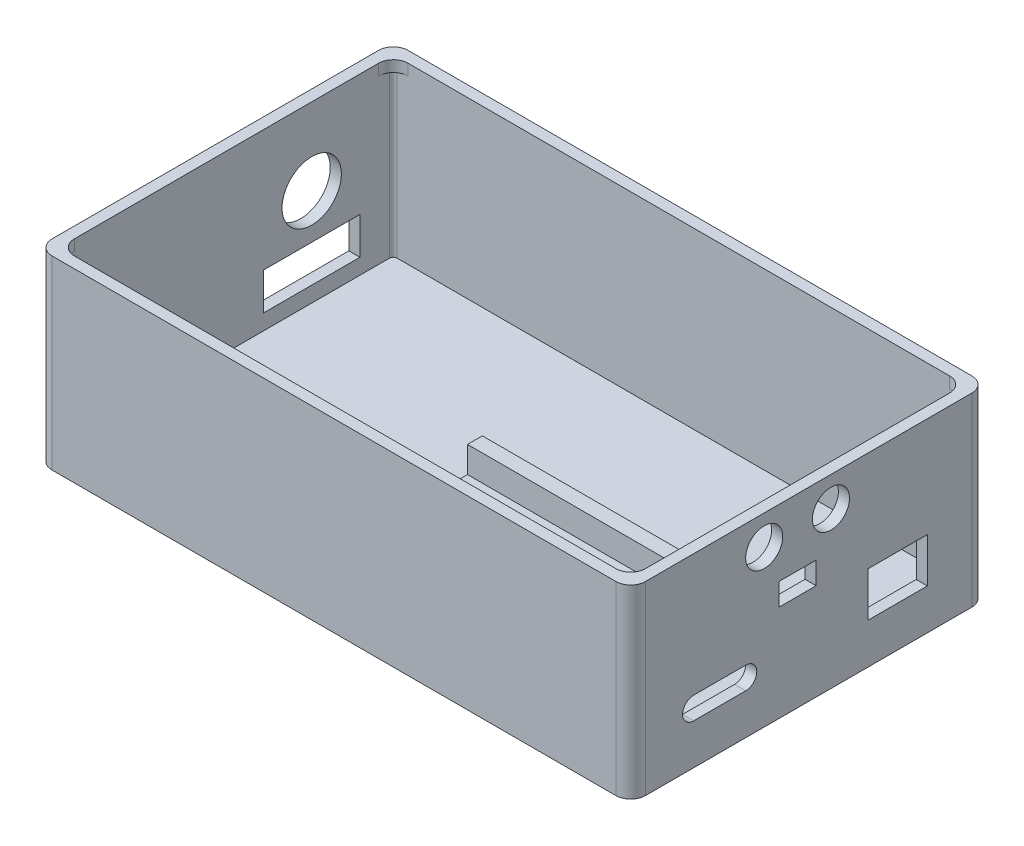
from build123d import *

# Parameters (mm, degrees)
SKETCH_3_W           = 80
SKETCH_3_H           = 48
EXTRUDE_1_DEPTH      = 25
FILLET_1_R           = 2
SHELL_1_T            = 1.5
SKETCH_5_W           = 45
SKETCH_5_H           = 2
EXTRUDE_2_DEPTH      = 8
EXTRUDE_START        = 4.48
EXTRUDE_3_DEPTH      = 4.48
SKETCH_8_W           = 8
SKETCH_8_H           = 6
CUT_EXTRUDE_2_DEPTH  = 4.03
CUT_EXTRUDE_3_DEPTH  = 4.03
SKETCH_11_W          = 13
SKETCH_11_H          = 5
CUT_EXTRUDE_4_DEPTH  = 4.03
SKETCH_12_W          = 5
SKETCH_12_H          = 3
CUT_EXTRUDE_5_DEPTH  = 4.03
SKETCH_13_R          = 2.5
CUT_EXTRUDE_6_DEPTH  = 4.03
SKETCH_14_R          = 4
CUT_EXTRUDE_7_DEPTH  = 4.03
CUT_EXTRUDE_12_DEPTH = 4.03
SKETCH_16_W          = 10
SKETCH_16_H          = 5
CUT_EXTRUDE_13_DEPTH = 4.03


with BuildPart() as part:
    # Эскиз3 → Бобышка-Вытянуть1 (new body)
    with BuildSketch(Plane(origin=(0, 0, 0), x_dir=(1, 0, 0), z_dir=(0, 1, 0))):
        Rectangle(SKETCH_3_W, SKETCH_3_H)
    extrude(amount=EXTRUDE_1_DEPTH)

    # Скругление1
    fillet_1_edges = [part.edges().sort_by_distance(p)[0] for p in [
        (40, 12.5, -24),
        (40, 12.5, 24),
        (-40, 12.5, 24),
        (-40, 12.5, -24),
    ]]
    fillet(fillet_1_edges, radius=FILLET_1_R)

    # Оболочка1 (no face opened: a closed hollow body)
    add(offset(amount=-SHELL_1_T, mode=Mode.PRIVATE), mode=Mode.SUBTRACT)

    # Эскиз5 → Бобышка-Вытянуть2 (add)
    with BuildSketch(Plane(origin=(0, 0, 0), x_dir=(1, 0, 0), z_dir=(0, 1, 0))):
        with Locations((17.5, 0)):
            Rectangle(SKETCH_5_W, SKETCH_5_H)
    extrude(amount=EXTRUDE_2_DEPTH)

    # Эскиз7 → Бобышка-Вытянуть3 (add)
    with BuildSketch(Plane(origin=(0, 0, 0), x_dir=(1, 0, 0), z_dir=(0, 1, 0)).offset(EXTRUDE_START)):
        with BuildLine():
            Line((40, -1), (-5, -1))
            Line((-5, -1), (-5, -24))
            Line((-5, -24), (38, -24))
            ThreePointArc((38, -24), (39.414213562, -23.414213562), (40, -22))
            Line((40, -22), (40, -1))
        make_face()
    extrude(amount=-EXTRUDE_3_DEPTH)

    # Эскиз8 → Вырез-Вытянуть2 (cut)
    with BuildSketch(Plane(origin=(40, 0, 0), x_dir=(0, 0, -1), z_dir=(1, 0, 0))):
        with Locations((12, 8.48)):
            Rectangle(SKETCH_8_W, SKETCH_8_H)
    extrude(amount=-CUT_EXTRUDE_2_DEPTH, mode=Mode.SUBTRACT)

    # Эскиз8<4> → Вырез-Вытянуть3 (cut)
    with BuildSketch(Plane(origin=(40, 0, 0), x_dir=(0, 0, -1), z_dir=(1, 0, 0))):
        with BuildLine():
            Line((-15.5, 5.48), (-8.5, 5.48))
            ThreePointArc((-8.5, 5.48), (-7.439339828, 5.919339828), (-7, 6.98))
            ThreePointArc((-7, 6.98), (-7.439339828, 8.040660172), (-8.5, 8.48))
            Line((-8.5, 8.48), (-15.5, 8.48))
            ThreePointArc((-15.5, 8.48), (-16.560660172, 8.040660172), (-17, 6.98))
            ThreePointArc((-17, 6.98), (-16.560660172, 5.919339828), (-15.5, 5.48))
        make_face()
    extrude(amount=-CUT_EXTRUDE_3_DEPTH, mode=Mode.SUBTRACT)

    # Эскиз11 → Вырез-Вытянуть4 (cut)
    with BuildSketch(Plane.ZY.offset(40)):
        with Locations((-11.5, 6.1)):
            Rectangle(SKETCH_11_W, SKETCH_11_H)
    extrude(amount=-CUT_EXTRUDE_4_DEPTH, mode=Mode.SUBTRACT)

    # Эскиз12 → Вырез-Вытянуть5 (cut)
    with BuildSketch(Plane(origin=(40, 0, 0), x_dir=(0, 0, -1), z_dir=(1, 0, 0))):
        with Locations((-1.5, 14.5)):
            Rectangle(SKETCH_12_W, SKETCH_12_H)
    extrude(amount=-CUT_EXTRUDE_5_DEPTH, mode=Mode.SUBTRACT)

    # Эскиз13 → Вырез-Вытянуть6 (cut)
    with BuildSketch(Plane(origin=(40, 0, 0), x_dir=(0, 0, -1), z_dir=(1, 0, 0))):
        with Locations((3, 21)):
            Circle(SKETCH_13_R)
        with Locations((-6, 21)):
            Circle(SKETCH_13_R)
    extrude(amount=-CUT_EXTRUDE_6_DEPTH, mode=Mode.SUBTRACT)

    # Эскиз14 → Вырез-Вытянуть7 (cut)
    with BuildSketch(Plane.ZY.offset(40)):
        with Locations((-11.5, 14.6)):
            Circle(SKETCH_14_R)
    extrude(amount=-CUT_EXTRUDE_7_DEPTH, mode=Mode.SUBTRACT)

    # Эскиз15 → Вырез-Вытянуть12 (cut)
    with BuildSketch(Plane(origin=(0, 25, 0), x_dir=(1, 0, 0), z_dir=(0, 1, 0))):
        with BuildLine():
            Line((38.5, -20.5), (38.5, 20.5))
            ThreePointArc((38.5, 20.5), (37.914213562, 21.914213562), (36.5, 22.5))
            Line((36.5, 22.5), (-36.5, 22.5))
            ThreePointArc((-36.5, 22.5), (-37.914213562, 21.914213562), (-38.5, 20.5))
            Line((-38.5, 20.5), (-38.5, -20.5))
            ThreePointArc((-38.5, -20.5), (-37.914213562, -21.914213562), (-36.5, -22.5))
            Line((-36.5, -22.5), (36.5, -22.5))
            ThreePointArc((36.5, -22.5), (37.914213562, -21.914213562), (38.5, -20.5))
        make_face()
    extrude(amount=-CUT_EXTRUDE_12_DEPTH, mode=Mode.SUBTRACT)

    # Эскиз16 → Вырез-Вытянуть13 (cut)
    with BuildSketch(Plane.ZY.offset(40)):
        with Locations((13, 7.98)):
            Rectangle(SKETCH_16_W, SKETCH_16_H)
    extrude(amount=-CUT_EXTRUDE_13_DEPTH, mode=Mode.SUBTRACT)


solid = part.part
